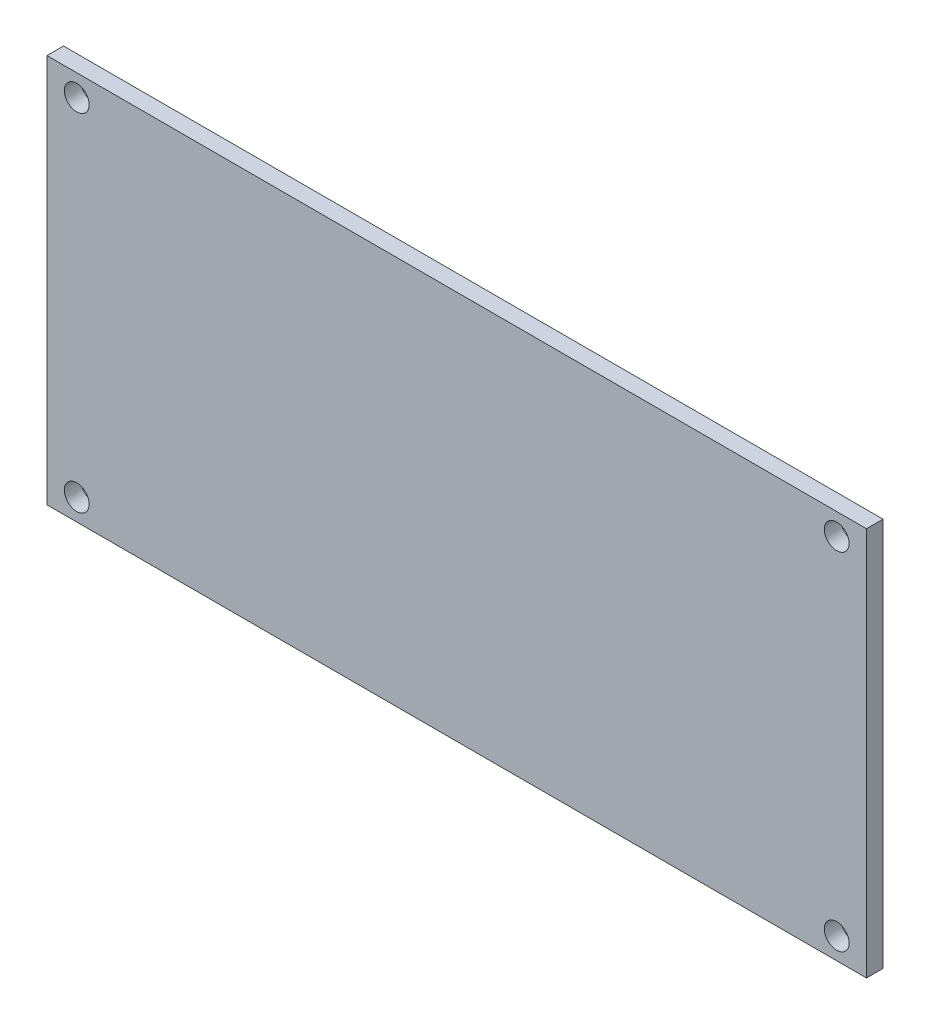
from build123d import *

# Parameters (mm, degrees)
SKETCH_1_W      = 99
SKETCH_1_H      = 47
SKETCH_1_R      = 1.5
EXTRUDE_1_DEPTH = 2


with BuildPart() as part:
    # Эскиз1 → Бобышка-Вытянуть1 (new body)
    with BuildSketch(Plane.XY):
        Rectangle(SKETCH_1_W, SKETCH_1_H)
        with Locations((-45.9, 20.9)):
            Circle(SKETCH_1_R, mode=Mode.SUBTRACT)
        with Locations(Location((45.9, 20.9, 0), (0, 0, 180))):
            Circle(SKETCH_1_R, mode=Mode.SUBTRACT)
        with Locations(Location((-45.9, -20.9, 0), (0, 0, 180))):
            Circle(SKETCH_1_R, mode=Mode.SUBTRACT)
        with Locations((45.9, -20.9)):
            Circle(SKETCH_1_R, mode=Mode.SUBTRACT)
    extrude(amount=EXTRUDE_1_DEPTH)


solid = part.part
